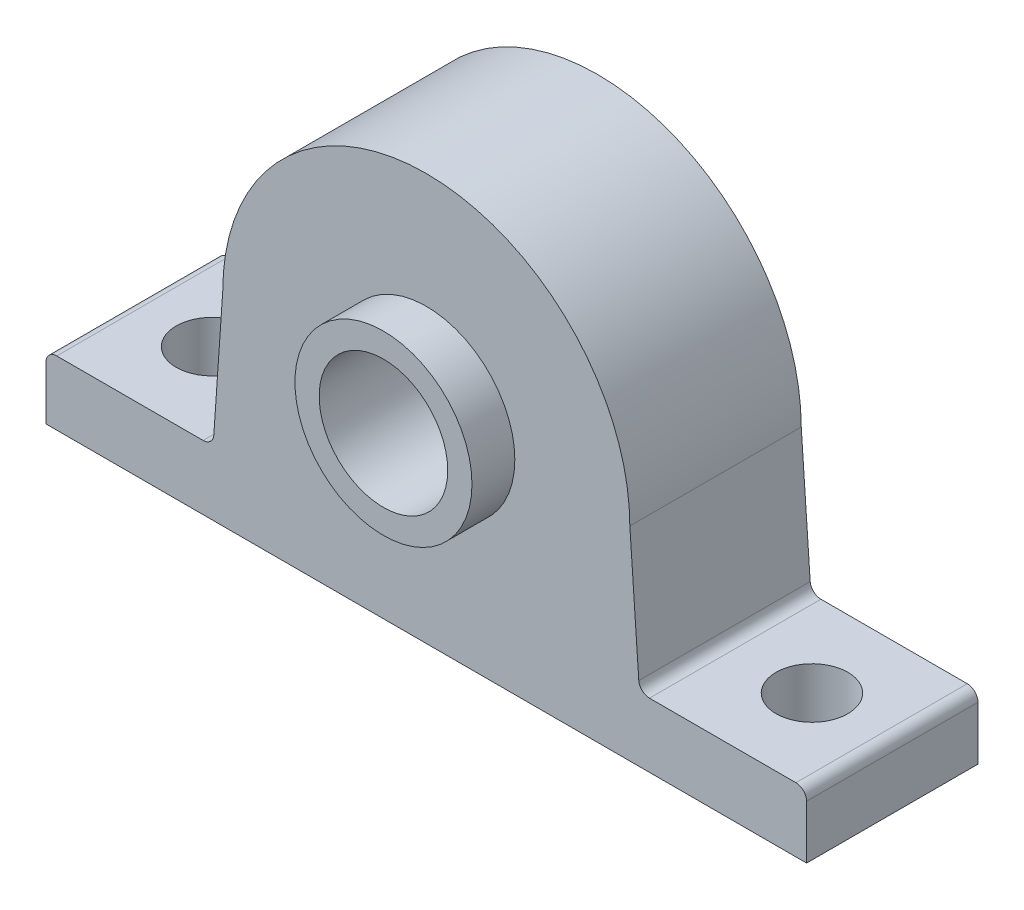
from build123d import *

# Parameters (mm, degrees)
SKETCH1_R           = 19
SKETCH1_R_2         = 6
BOSS_EXTRUDE1_DEPTH = 16
SKETCH2_R           = 8.265
SKETCH2_R_2         = 6
BOSS_EXTRUDE2_DEPTH = 4
FILLET1_R           = 1
CUT_EXTRUDE1_REACH  = 57.716
SKETCH3_R           = 3.35


with BuildPart() as part:
    # Sketch1 → Boss-Extrude1 (new body)
    # profile 1 of 3: a face of its own
    with BuildSketch(Plane.XY):
        with BuildLine():
            Line((-35.5, -13), (-35.5, -19))
            Line((-35.5, -19), (-3.6e-08, -19))
            ThreePointArc((-3.6e-08, -19), (-13.435028855, -13.43502883), (-19, 0))
            Line((-19, 0), (-19.9, -13))
            Line((-19.9, -13), (-35.5, -13))
        make_face()
    # profile 2 of 3: a face of its own
    with BuildSketch(Plane.XY):
        Circle(SKETCH1_R)
        Circle(SKETCH1_R_2, mode=Mode.SUBTRACT)
    # profile 3 of 3: a face of its own
    with BuildSketch(Plane.XY):
        with BuildLine():
            ThreePointArc((19, 0), (13.43502883, -13.435028855), (-3.6e-08, -19))
            Line((-3.6e-08, -19), (35.5, -19))
            Line((35.5, -19), (35.5, -13))
            Line((35.5, -13), (19.9, -13))
            Line((19.9, -13), (19, 0))
        make_face()
    extrude(amount=BOSS_EXTRUDE1_DEPTH)

    # Sketch2 → Boss-Extrude2 (add)
    with BuildSketch(Plane.XY.offset(16)):
        Circle(SKETCH2_R)
        Circle(SKETCH2_R_2, mode=Mode.SUBTRACT)
    extrude(amount=BOSS_EXTRUDE2_DEPTH)

    # Fillet1
    fillet1_edges = [part.edges().sort_by_distance(p)[0] for p in [
        (-35.5, -13, 8),
        (-19.9, -13, 8),
        (19.9, -13, 8),
        (35.5, -13, 8),
    ]]
    fillet(fillet1_edges, radius=FILLET1_R)

    # Sketch3 → Cut-Extrude1 (cut, up to next)
    with BuildSketch(Plane.XZ.offset(19), mode=Mode.PRIVATE) as cut_extrude1_sk1:
        with Locations(Location((28, 8, 0), (0, 0, 270))):
            Circle(SKETCH3_R)
    cut_extrude1_tool1 = extrude(cut_extrude1_sk1.sketch, amount=-CUT_EXTRUDE1_REACH, mode=Mode.PRIVATE) & part.part
    # Sketch3 → Cut-Extrude1 (cut, up to next)
    with BuildSketch(Plane.XZ.offset(19), mode=Mode.PRIVATE) as cut_extrude1_sk2:
        with Locations(Location((-28, 8, 0), (0, 0, 90))):
            Circle(SKETCH3_R)
    cut_extrude1_tool2 = extrude(cut_extrude1_sk2.sketch, amount=-CUT_EXTRUDE1_REACH, mode=Mode.PRIVATE) & part.part
    add(cut_extrude1_tool1.solids().sort_by_distance((28, -19, 8))[0], mode=Mode.SUBTRACT)
    add(cut_extrude1_tool2.solids().sort_by_distance((-28, -19, 8))[0], mode=Mode.SUBTRACT)


solid = part.part
